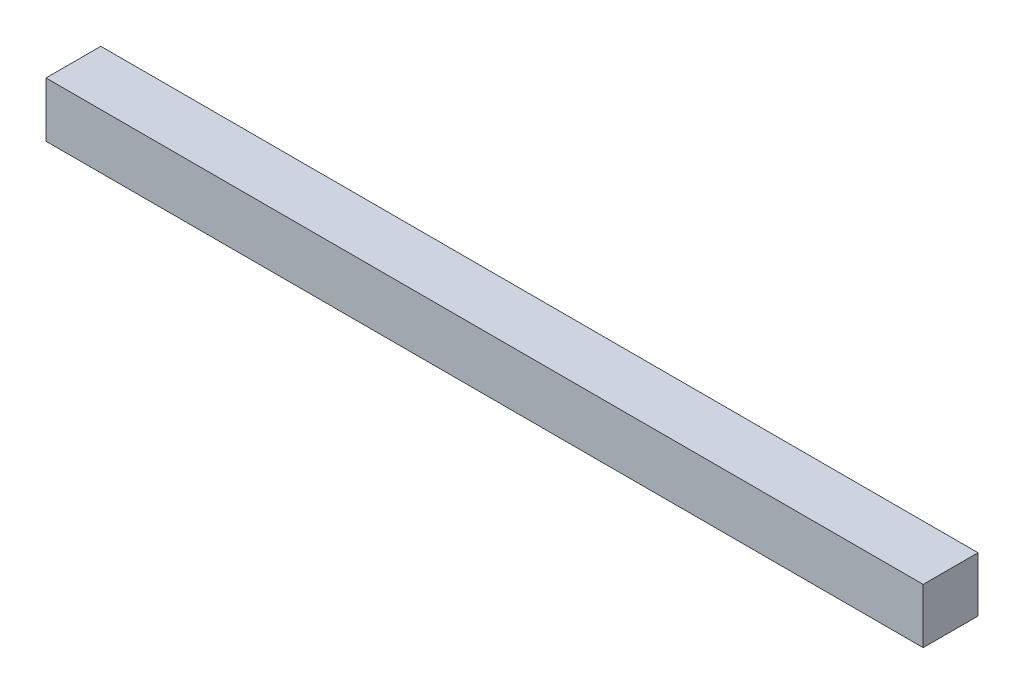
from build123d import *

# Parameters (mm, degrees)
BELT_DRIVE_AXLE_W   = 101.6
BELT_DRIVE_AXLE_H   = 6.35
BOSS_EXTRUDE1_DEPTH = 6.35


with BuildPart() as part:
    # Belt Drive Axle → Boss-Extrude1 (new body)
    with BuildSketch(Plane(origin=(0, 0, 0), x_dir=(1, 0, 0), z_dir=(0, 1, 0))):
        Rectangle(BELT_DRIVE_AXLE_W, BELT_DRIVE_AXLE_H)
    extrude(amount=BOSS_EXTRUDE1_DEPTH)


solid = part.part
